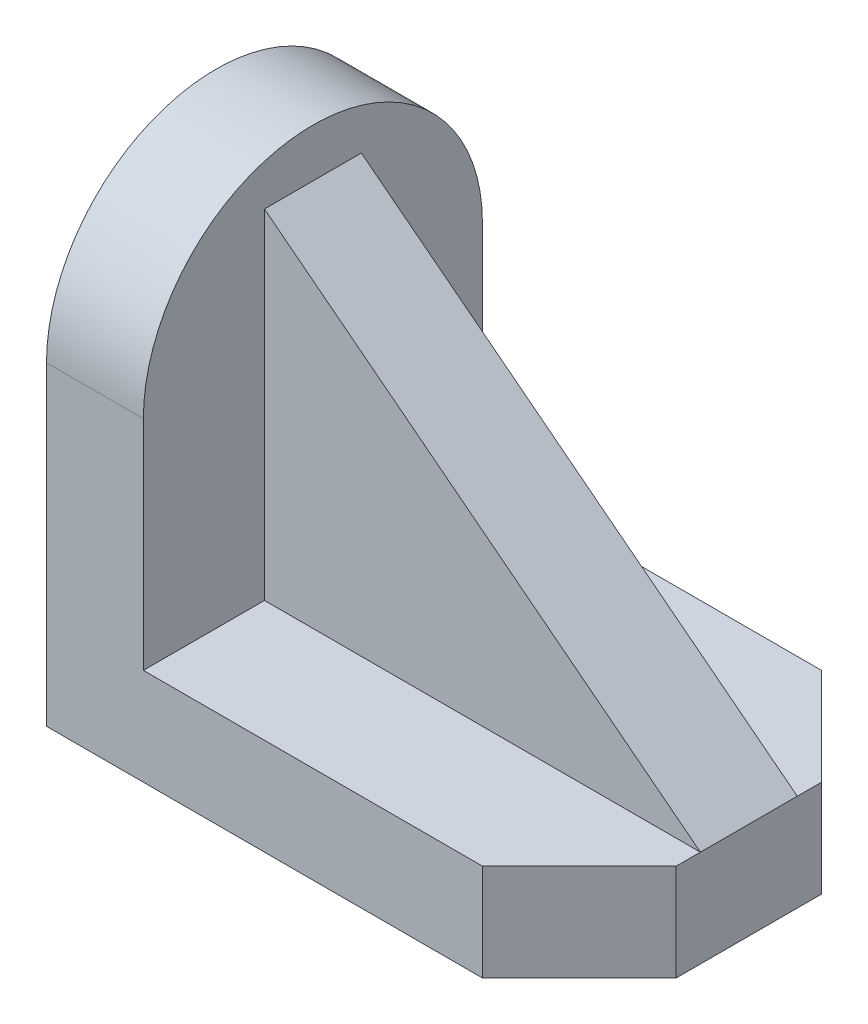
from build123d import *

# Parameters (mm, degrees)
SKETCH1_W                = 66
SKETCH1_H                = 42
BOSS_EXTRUDE1_DEPTH      = 12
CHAMFER1_SIZE            = 12
CHAMFER2_SIZE            = 12
BOSS_EXTRUDE2_DEPTH      = 12
BOSS_EXTRUDE3_DEPTH      = 6
BOSS_EXTRUDE3_DEPTH_BACK = 6


with BuildPart() as part:
    # Sketch1 → Boss-Extrude1 (new body)
    with BuildSketch(Plane(origin=(0, 0, 0), x_dir=(1, 0, 0), z_dir=(0, 1, 0))):
        Rectangle(SKETCH1_W, SKETCH1_H)
    extrude(amount=BOSS_EXTRUDE1_DEPTH)

    # Chamfer1
    chamfer1_edges = [part.edges().sort_by_distance(p)[0] for p in [
        (33, 6, 21),
    ]]
    chamfer(chamfer1_edges, length=CHAMFER1_SIZE)

    # Chamfer2
    chamfer2_edges = [part.edges().sort_by_distance(p)[0] for p in [
        (33, 6, -21),
    ]]
    chamfer(chamfer2_edges, length=CHAMFER2_SIZE)

    # Sketch2 → Boss-Extrude2 (add)
    with BuildSketch(Plane.ZY.offset(33)):
        with BuildLine():
            Line((-21, 12), (-21, 39))
            ThreePointArc((-21, 39), (0, 60), (21, 39))
            Line((21, 39), (21, 12))
            Line((21, 12), (-21, 12))
        make_face()
    extrude(amount=-BOSS_EXTRUDE2_DEPTH)

    # Sketch11 → Boss-Extrude3 (add, two sides: drawn at the far end of the back side and taken through both)
    with BuildSketch(Plane.XY.offset(-BOSS_EXTRUDE3_DEPTH_BACK)):
        Polygon((-21, 54), (-21, 12), (33, 12), align=None)
    extrude(amount=BOSS_EXTRUDE3_DEPTH + BOSS_EXTRUDE3_DEPTH_BACK)


solid = part.part
